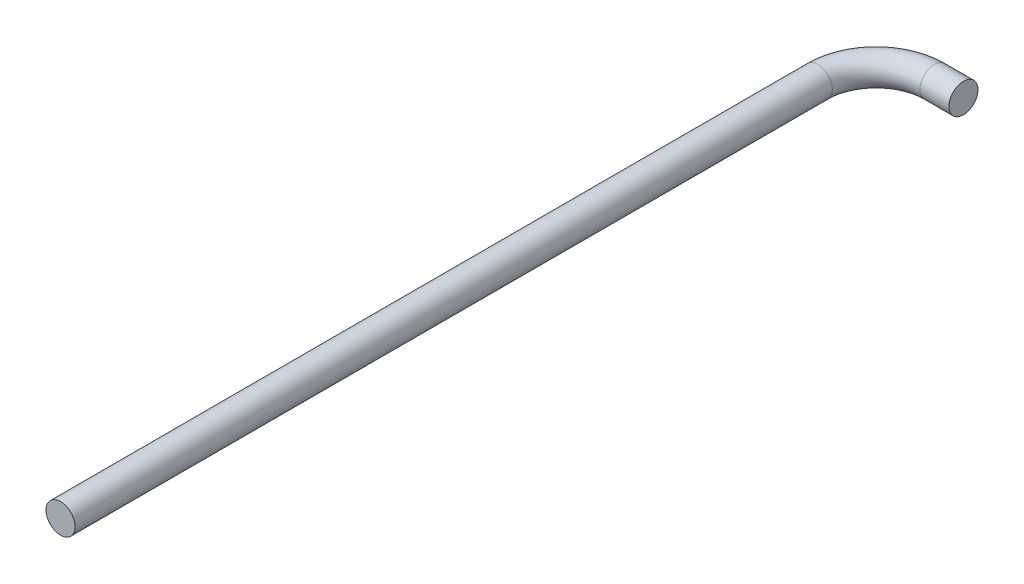
from build123d import *

# Parameters (mm, degrees)
ESQUISSE1_R        = 2.5
R_VOLUTION1_ANGLE  = 90
ESQUISSE2_R        = 2.5
BOSS_EXTRU_1_DEPTH = 130
ESQUISSE3_R        = 2.5
BOSS_EXTRU_2_DEPTH = 5


with BuildPart() as part:
    # Esquisse1 → Révolution1 (revolve)
    with BuildSketch(Plane.XY):
        with Locations((-10, 0)):
            Circle(ESQUISSE1_R)
    revolve(axis=Axis((0, 7.956307344, 0), (0, -1, 0)), revolution_arc=R_VOLUTION1_ANGLE)

    # Esquisse2 → Boss.-Extru.1 (add)
    with BuildSketch(Plane.XY):
        with Locations(Location((-10, 0, 0), (0, 0, 180))):
            Circle(ESQUISSE2_R)
    extrude(amount=BOSS_EXTRU_1_DEPTH)

    # Esquisse3 → Boss.-Extru.2 (add)
    with BuildSketch(Plane(origin=(0, 0, 0), x_dir=(0, 0, -1), z_dir=(1, 0, 0))):
        with Locations((10, 0)):
            Circle(ESQUISSE3_R)
    extrude(amount=BOSS_EXTRU_2_DEPTH)


solid = part.part
